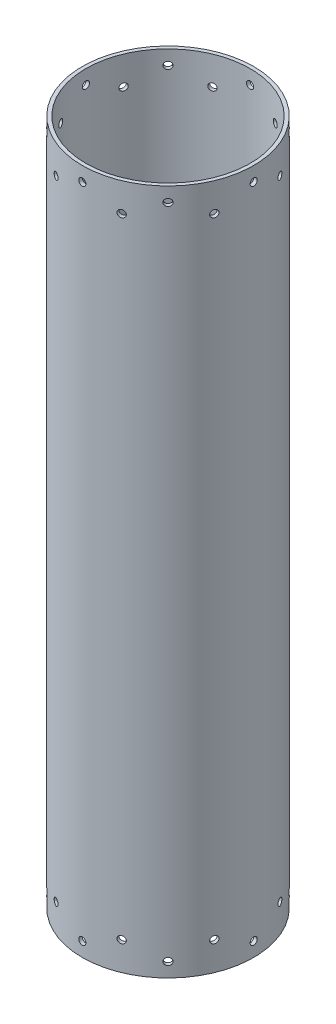
from build123d import *

# Parameters (mm, degrees)
SKETCH2_R                = 76.2
SKETCH2_R_2              = 73.025
BOSS_EXTRUDE1_DEPTH      = 609.6
SKETCH3_R                = 3.175
CUT_EXTRUDE1_DEPTH       = 1143
CIRPATTERN1_COUNT        = 8
SKETCH6_R                = 3.175
CUT_EXTRUDE2_DEPTH       = 25.4
CIRPATTERN2_COUNT        = 8
MIRROR1_COPY_1_SKETCH_R  = 3.175
MIRROR1_COPY_1_DEPTH     = 1143
MIRROR1_COPY_2_SKETCH_R  = 3.175
MIRROR1_COPY_2_DEPTH     = 1143
MIRROR1_COPY_3_SKETCH_R  = 3.175
MIRROR1_COPY_3_DEPTH     = 1143
MIRROR1_COPY_4_SKETCH_R  = 3.175
MIRROR1_COPY_4_DEPTH     = 1143
MIRROR1_COPY_5_SKETCH_R  = 3.175
MIRROR1_COPY_5_DEPTH     = 1143
MIRROR1_COPY_6_SKETCH_R  = 3.175
MIRROR1_COPY_6_DEPTH     = 1143
MIRROR1_COPY_7_SKETCH_R  = 3.175
MIRROR1_COPY_7_DEPTH     = 1143
MIRROR1_COPY_8_SKETCH_R  = 3.175
MIRROR1_COPY_8_DEPTH     = 25.4
MIRROR1_COPY_9_SKETCH_R  = 3.175
MIRROR1_COPY_9_DEPTH     = 25.4
MIRROR1_COPY_10_SKETCH_R = 3.175
MIRROR1_COPY_10_DEPTH    = 25.4
MIRROR1_COPY_11_SKETCH_R = 3.175
MIRROR1_COPY_11_DEPTH    = 25.4
MIRROR1_COPY_12_SKETCH_R = 3.175
MIRROR1_COPY_12_DEPTH    = 25.4
MIRROR1_COPY_13_SKETCH_R = 3.175
MIRROR1_COPY_13_DEPTH    = 25.4
MIRROR1_COPY_14_SKETCH_R = 3.175
MIRROR1_COPY_14_DEPTH    = 25.4


with BuildPart() as part:
    # Sketch2 → Boss-Extrude1 (new body)
    with BuildSketch(Plane(origin=(0, 0, 0), x_dir=(1, 0, 0), z_dir=(0, 1, 0))):
        with Locations(Location((0, 0, 0), (0, 0, 90))):
            Circle(SKETCH2_R)
        with Locations(Location((0, 0, 0), (0, 0, 90))):
            Circle(SKETCH2_R_2, mode=Mode.SUBTRACT)
    extrude(amount=BOSS_EXTRUDE1_DEPTH)

    # Sketch3 → Cut-Extrude1 (cut)
    with BuildSketch(Plane.XY):
        with Locations(Location((0, 596.9, 0), (0, 0, 90))):
            Circle(SKETCH3_R)
    cut_extrude1 = extrude(amount=-CUT_EXTRUDE1_DEPTH, mode=Mode.SUBTRACT)

    # CirPattern1: Cut-Extrude1 ×8 about axis
    cirpattern1_axis = Axis((0, 609.6, 0), (0, -1, 0))
    for i in range(1, CIRPATTERN1_COUNT):
        add(cut_extrude1.rotate(cirpattern1_axis, i * 360 / CIRPATTERN1_COUNT), mode=Mode.SUBTRACT)

    # Sketch6 → Cut-Extrude2 (cut)
    with BuildSketch(Plane(origin=(-29.160477546, 0, 70.399620377), x_dir=(0, -1, 0), z_dir=(-0.3826834323650906, 0, 0.9238795325112865))):
        with Locations(Location((-584.2, 0, 0), (0, 0, 90))):
            Circle(SKETCH6_R)
    cut_extrude2 = extrude(amount=-CUT_EXTRUDE2_DEPTH, mode=Mode.SUBTRACT)

    # CirPattern2: Cut-Extrude2 ×8 about axis
    cirpattern2_axis = Axis((0, 609.6, 0), (0, -1, 0))
    for i in range(1, CIRPATTERN2_COUNT):
        add(cut_extrude2.rotate(cirpattern2_axis, i * 360 / CIRPATTERN2_COUNT), mode=Mode.SUBTRACT)

    # Mirror1: Cut-Extrude1, Cut-Extrude2 across plane
    add(cut_extrude1.mirror(Plane.ZX.offset(304.8)), mode=Mode.SUBTRACT)
    add(cut_extrude2.mirror(Plane.ZX.offset(304.8)), mode=Mode.SUBTRACT)

    # Mirror1 copy 1 sketch → Mirror1 copy 1 (cut)
    with BuildSketch(Plane(origin=(0, 609.6, 0), x_dir=(0.7071067811865476, 0, 0.7071067811865475), z_dir=(-0.7071067811865475, 0, 0.7071067811865476))):
        with Locations((0, -596.9)):
            Circle(MIRROR1_COPY_1_SKETCH_R)
    extrude(amount=-MIRROR1_COPY_1_DEPTH, mode=Mode.SUBTRACT)

    # Mirror1 copy 2 sketch → Mirror1 copy 2 (cut)
    with BuildSketch(Plane(origin=(0, 609.6, 0), x_dir=(0, 0, 1), z_dir=(-1, 0, 0))):
        with Locations((0, -596.9)):
            Circle(MIRROR1_COPY_2_SKETCH_R)
    extrude(amount=-MIRROR1_COPY_2_DEPTH, mode=Mode.SUBTRACT)

    # Mirror1 copy 3 sketch → Mirror1 copy 3 (cut)
    with BuildSketch(Plane(origin=(0, 609.6, 0), x_dir=(-0.7071067811865475, 0, 0.7071067811865476), z_dir=(-0.7071067811865476, 0, -0.7071067811865475))):
        with Locations((0, -596.9)):
            Circle(MIRROR1_COPY_3_SKETCH_R)
    extrude(amount=-MIRROR1_COPY_3_DEPTH, mode=Mode.SUBTRACT)

    # Mirror1 copy 4 sketch → Mirror1 copy 4 (cut)
    with BuildSketch(Plane(origin=(0, 609.6, 0), x_dir=(-1, 0, 0), z_dir=(0, 0, -1))):
        with Locations((0, -596.9)):
            Circle(MIRROR1_COPY_4_SKETCH_R)
    extrude(amount=-MIRROR1_COPY_4_DEPTH, mode=Mode.SUBTRACT)

    # Mirror1 copy 5 sketch → Mirror1 copy 5 (cut)
    with BuildSketch(Plane(origin=(0, 609.6, 0), x_dir=(-0.7071067811865477, 0, -0.7071067811865475), z_dir=(0.7071067811865475, 0, -0.7071067811865477))):
        with Locations((0, -596.9)):
            Circle(MIRROR1_COPY_5_SKETCH_R)
    extrude(amount=-MIRROR1_COPY_5_DEPTH, mode=Mode.SUBTRACT)

    # Mirror1 copy 6 sketch → Mirror1 copy 6 (cut)
    with BuildSketch(Plane(origin=(0, 609.6, 0), x_dir=(0, 0, -1), z_dir=(1, 0, 0))):
        with Locations((0, -596.9)):
            Circle(MIRROR1_COPY_6_SKETCH_R)
    extrude(amount=-MIRROR1_COPY_6_DEPTH, mode=Mode.SUBTRACT)

    # Mirror1 copy 7 sketch → Mirror1 copy 7 (cut)
    with BuildSketch(Plane(origin=(0, 609.6, 0), x_dir=(0.7071067811865474, 0, -0.7071067811865477), z_dir=(0.7071067811865477, 0, 0.7071067811865474))):
        with Locations((0, -596.9)):
            Circle(MIRROR1_COPY_7_SKETCH_R)
    extrude(amount=-MIRROR1_COPY_7_DEPTH, mode=Mode.SUBTRACT)

    # Mirror1 copy 8 sketch → Mirror1 copy 8 (cut)
    with BuildSketch(Plane(origin=(-70.399620377, 609.6, 29.160477546), x_dir=(0, 1, 0), z_dir=(-0.9238795325112872, 0, 0.3826834323650891))):
        with Locations((-584.2, 0)):
            Circle(MIRROR1_COPY_8_SKETCH_R)
    extrude(amount=-MIRROR1_COPY_8_DEPTH, mode=Mode.SUBTRACT)

    # Mirror1 copy 9 sketch → Mirror1 copy 9 (cut)
    with BuildSketch(Plane(origin=(-70.399620377, 609.6, -29.160477546), x_dir=(0, 1, 0), z_dir=(-0.9238795325112865, 0, -0.38268343236509056))):
        with Locations((-584.2, 0)):
            Circle(MIRROR1_COPY_9_SKETCH_R)
    extrude(amount=-MIRROR1_COPY_9_DEPTH, mode=Mode.SUBTRACT)

    # Mirror1 copy 10 sketch → Mirror1 copy 10 (cut)
    with BuildSketch(Plane(origin=(-29.160477546, 609.6, -70.399620377), x_dir=(0, 1, 0), z_dir=(-0.3826834323650891, 0, -0.9238795325112872))):
        with Locations((-584.2, 0)):
            Circle(MIRROR1_COPY_10_SKETCH_R)
    extrude(amount=-MIRROR1_COPY_10_DEPTH, mode=Mode.SUBTRACT)

    # Mirror1 copy 11 sketch → Mirror1 copy 11 (cut)
    with BuildSketch(Plane(origin=(29.160477546, 609.6, -70.399620377), x_dir=(0, 1, 0), z_dir=(0.3826834323650905, 0, -0.9238795325112865))):
        with Locations((-584.2, 0)):
            Circle(MIRROR1_COPY_11_SKETCH_R)
    extrude(amount=-MIRROR1_COPY_11_DEPTH, mode=Mode.SUBTRACT)

    # Mirror1 copy 12 sketch → Mirror1 copy 12 (cut)
    with BuildSketch(Plane(origin=(70.399620377, 609.6, -29.160477546), x_dir=(0, 1, 0), z_dir=(0.9238795325112872, 0, -0.3826834323650892))):
        with Locations((-584.2, 0)):
            Circle(MIRROR1_COPY_12_SKETCH_R)
    extrude(amount=-MIRROR1_COPY_12_DEPTH, mode=Mode.SUBTRACT)

    # Mirror1 copy 13 sketch → Mirror1 copy 13 (cut)
    with BuildSketch(Plane(origin=(70.399620377, 609.6, 29.160477546), x_dir=(0, 1, 0), z_dir=(0.9238795325112866, 0, 0.38268343236509045))):
        with Locations((-584.2, 0)):
            Circle(MIRROR1_COPY_13_SKETCH_R)
    extrude(amount=-MIRROR1_COPY_13_DEPTH, mode=Mode.SUBTRACT)

    # Mirror1 copy 14 sketch → Mirror1 copy 14 (cut)
    with BuildSketch(Plane(origin=(29.160477546, 609.6, 70.399620377), x_dir=(0, 1, 0), z_dir=(0.3826834323650893, 0, 0.9238795325112872))):
        with Locations((-584.2, 0)):
            Circle(MIRROR1_COPY_14_SKETCH_R)
    extrude(amount=-MIRROR1_COPY_14_DEPTH, mode=Mode.SUBTRACT)


solid = part.part
